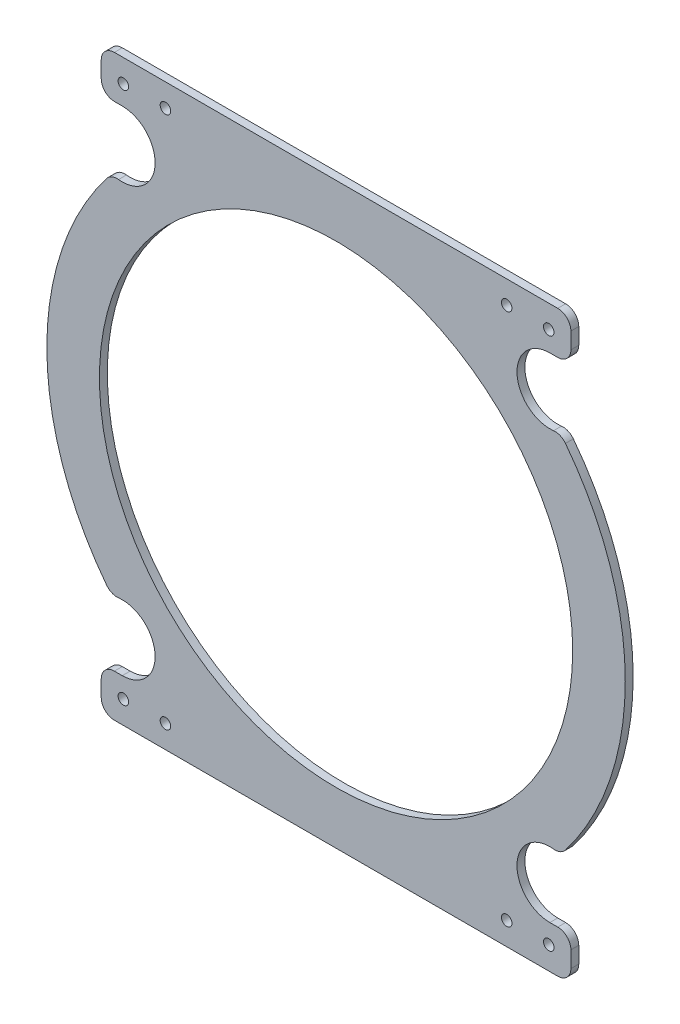
from build123d import *

# Parameters (mm, degrees)
IZIM1_R                     = 2
IZIM1_R_2                   = 90
Y_KSEKLIK_EKSTR_ZYON1_DEPTH = 3
FILLET1_R                   = 5


with BuildPart() as part:
    # Çizim1 → Yükseklik-Ekstrüzyon1 (new body)
    with BuildSketch(Plane.XY):
        with BuildLine():
            ThreePointArc((81.317279836, -93.817279836), (68.980438262, -79.304237374), (85.290813588, -69.46565423))
            ThreePointArc((85.290813588, -69.46565423), (110, 0), (85.290813588, 69.46565423))
            ThreePointArc((85.290813588, 69.46565423), (68.980438262, 79.304237374), (81.317279836, 93.817279836))
            Line((81.317279836, 93.817279836), (89.317279836, 93.817279836))
            Line((89.317279836, 93.817279836), (89.317279836, 110))
            Line((89.317279836, 110), (-89.317279836, 110))
            Line((-89.317279836, 110), (-89.317279836, 93.817279836))
            Line((-89.317279836, 93.817279836), (-81.317279836, 93.817279836))
            ThreePointArc((-81.317279836, 93.817279836), (-68.980438262, 79.304237374), (-85.290813588, 69.46565423))
            ThreePointArc((-85.290813588, 69.46565423), (-110, 0), (-85.290813588, -69.46565423))
            ThreePointArc((-85.290813588, -69.46565423), (-68.980438262, -79.304237374), (-81.317279836, -93.817279836))
            Line((-81.317279836, -93.817279836), (-89.317279836, -93.817279836))
            Line((-89.317279836, -93.817279836), (-89.317279836, -110))
            Line((-89.317279836, -110), (89.317279836, -110))
            Line((89.317279836, -110), (89.317279836, -93.817279836))
            Line((89.317279836, -93.817279836), (81.317279836, -93.817279836))
        make_face()
        with Locations((-80.9, -101.317279836)):
            Circle(IZIM1_R, mode=Mode.SUBTRACT)
        with Locations((80.9, -101.317279836)):
            Circle(IZIM1_R, mode=Mode.SUBTRACT)
        Circle(IZIM1_R_2, mode=Mode.SUBTRACT)
        with Locations((64.9, 101.317279836)):
            Circle(IZIM1_R, mode=Mode.SUBTRACT)
        with Locations((80.9, 101.317279836)):
            Circle(IZIM1_R, mode=Mode.SUBTRACT)
        with Locations((-80.9, 101.317279836)):
            Circle(IZIM1_R, mode=Mode.SUBTRACT)
        with Locations((-64.9, 101.317279836)):
            Circle(IZIM1_R, mode=Mode.SUBTRACT)
        with Locations((64.9, -101.317279836)):
            Circle(IZIM1_R, mode=Mode.SUBTRACT)
        with Locations((-64.9, -101.317279836)):
            Circle(IZIM1_R, mode=Mode.SUBTRACT)
    extrude(amount=Y_KSEKLIK_EKSTR_ZYON1_DEPTH)

    # Fillet1
    fillet1_edges = [part.edges().sort_by_distance(p)[0] for p in [
        (89.317279836, -93.817279836, 1.5),
        (89.317279836, -110, 1.5),
        (-89.317279836, -110, 1.5),
        (-89.317279836, -93.817279836, 1.5),
        (-85.290813588, -69.46565423, 1.5),
        (-85.290813588, 69.46565423, 1.5),
        (-89.317279836, 93.817279836, 1.5),
        (-89.317279836, 110, 1.5),
        (89.317279836, 110, 1.5),
        (89.317279836, 93.817279836, 1.5),
        (85.290813588, 69.46565423, 1.5),
        (85.290813588, -69.46565423, 1.5),
    ]]
    fillet(fillet1_edges, radius=FILLET1_R)


solid = part.part
